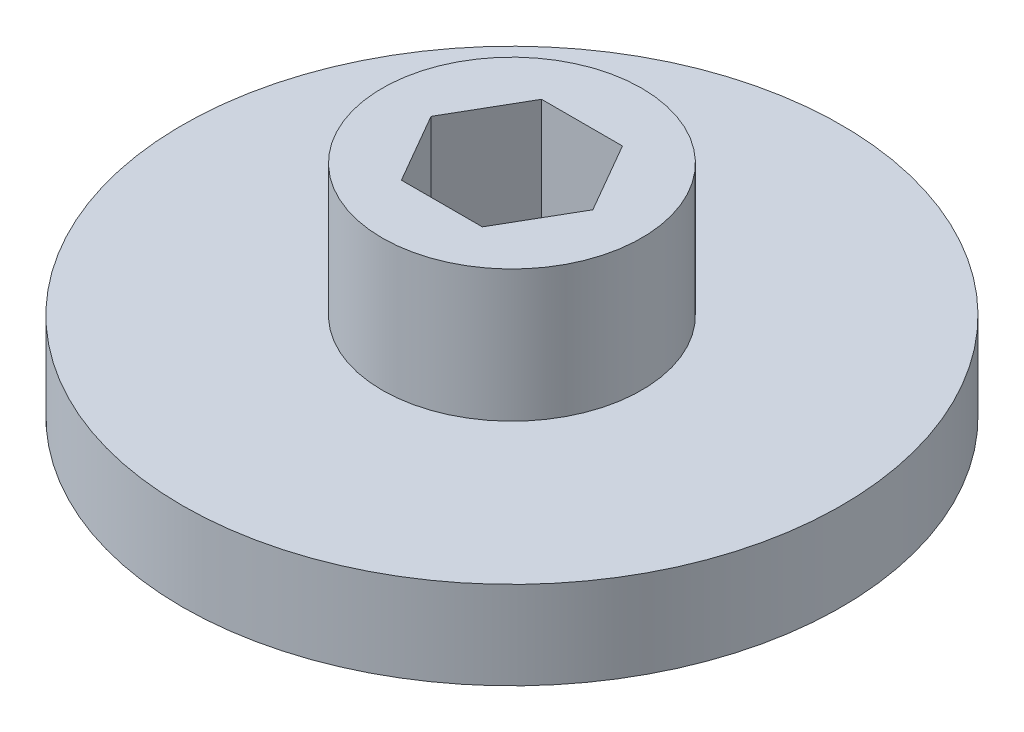
from build123d import *

# Parameters (mm, degrees)
SKETCH1_R           = 19.05
BOSS_EXTRUDE1_DEPTH = 5.08
SKETCH3_R           = 7.5
BOSS_EXTRUDE2_DEPTH = 7.62
CUT_EXTRUDE1_DEPTH  = 7.62
SKETCH5_R           = 15.494
CUT_EXTRUDE2_DEPTH  = 3.81


with BuildPart() as part:
    # Sketch1 → Boss-Extrude1 (new body)
    with BuildSketch(Plane(origin=(0, 0, 0), x_dir=(1, 0, 0), z_dir=(0, 1, 0))):
        with Locations(Location((0, 0, 0), (0, 0, 270))):
            Circle(SKETCH1_R)
    extrude(amount=BOSS_EXTRUDE1_DEPTH)

    # Sketch3 → Boss-Extrude2 (add)
    with BuildSketch(Plane(origin=(0, 5.08, 0), x_dir=(1, 0, 0), z_dir=(0, 1, 0))):
        with Locations(Location((0, 0, 0), (0, 0, 90))):
            Circle(SKETCH3_R)
    extrude(amount=BOSS_EXTRUDE2_DEPTH)

    # Sketch4 → Cut-Extrude1 (cut)
    with BuildSketch(Plane(origin=(0, 12.7, 0), x_dir=(1, 0, 0), z_dir=(0, 1, 0))):
        Polygon((4.67653718, 0), (2.33826859, 4.05), (-2.33826859, 4.05), (-4.67653718, 0), (-2.33826859, -4.05), (2.33826859, -4.05), align=None)
    extrude(amount=-CUT_EXTRUDE1_DEPTH, mode=Mode.SUBTRACT)

    # Sketch5 → Cut-Extrude2 (cut)
    with BuildSketch(Plane.XZ):
        with Locations(Location((0, 0, 0), (0, 0, 270))):
            Circle(SKETCH5_R)
    extrude(amount=-CUT_EXTRUDE2_DEPTH, mode=Mode.SUBTRACT)


solid = part.part
